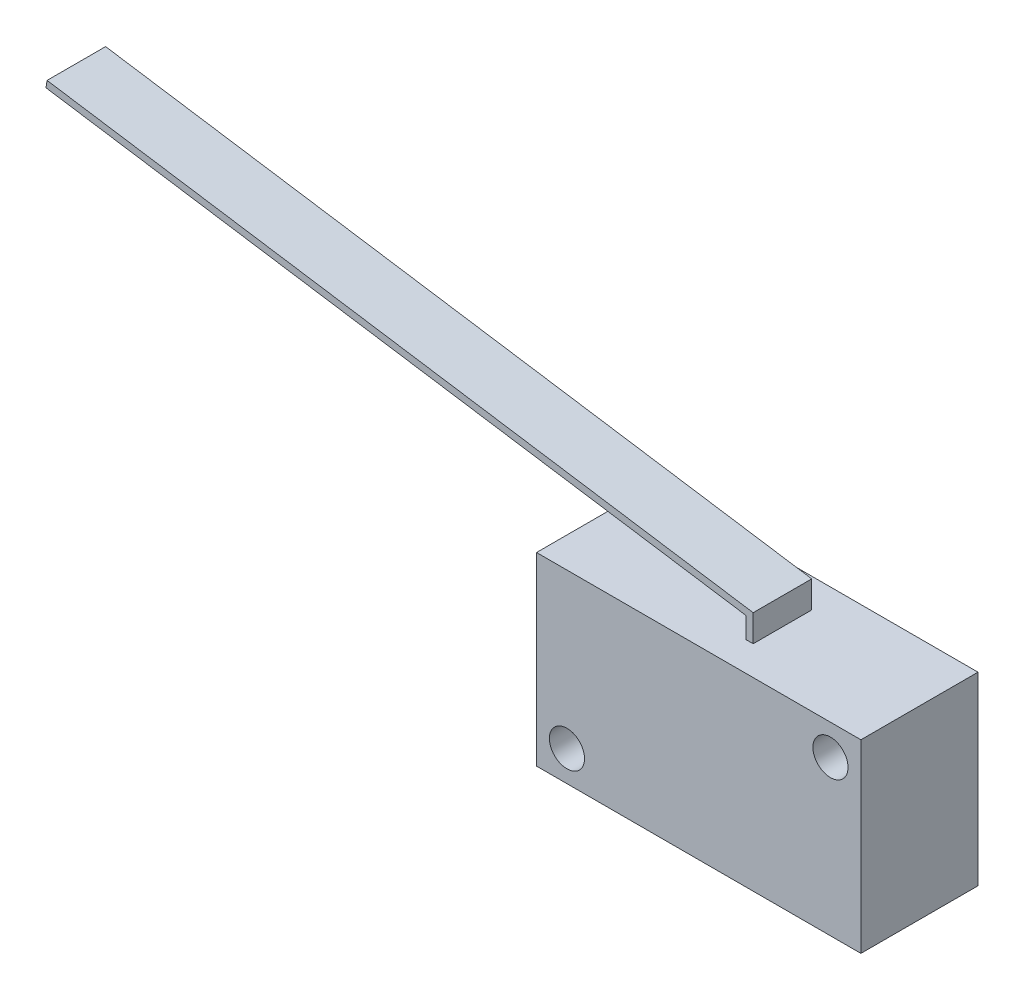
from build123d import *

# Parameters (mm, degrees)
SKETCH_1_W        = 27.7
SKETCH_1_H        = 15.8
SKETCH_1_R        = 1.5
EXTRUDE_1_DEPTH   = 5
EXTRUDE_1_2_DEPTH = 2.5


with BuildPart() as part:
    # ｽｹｯﾁ1 → Extrude 1 (new, symmetric)
    with BuildSketch(Plane.XY):
        Rectangle(SKETCH_1_W, SKETCH_1_H)
        with Locations((11.25, 5.3)):
            Circle(SKETCH_1_R, mode=Mode.SUBTRACT)
        with Locations((-11.25, -5.3)):
            Circle(SKETCH_1_R, mode=Mode.SUBTRACT)
    extrude(amount=EXTRUDE_1_DEPTH, both=True)

    # ｽｹｯﾁ2 → Extrude 1 2 (add, symmetric)
    with BuildSketch(Plane.XY):
        Polygon((2.15, 7.9), (2.15, 10.2), (-58.15, 19.414662229), (-58.240636022, 18.821547475), (1.55, 9.684723007), (1.55, 7.9), align=None)
    extrude(amount=EXTRUDE_1_2_DEPTH, both=True)


solid = part.part
